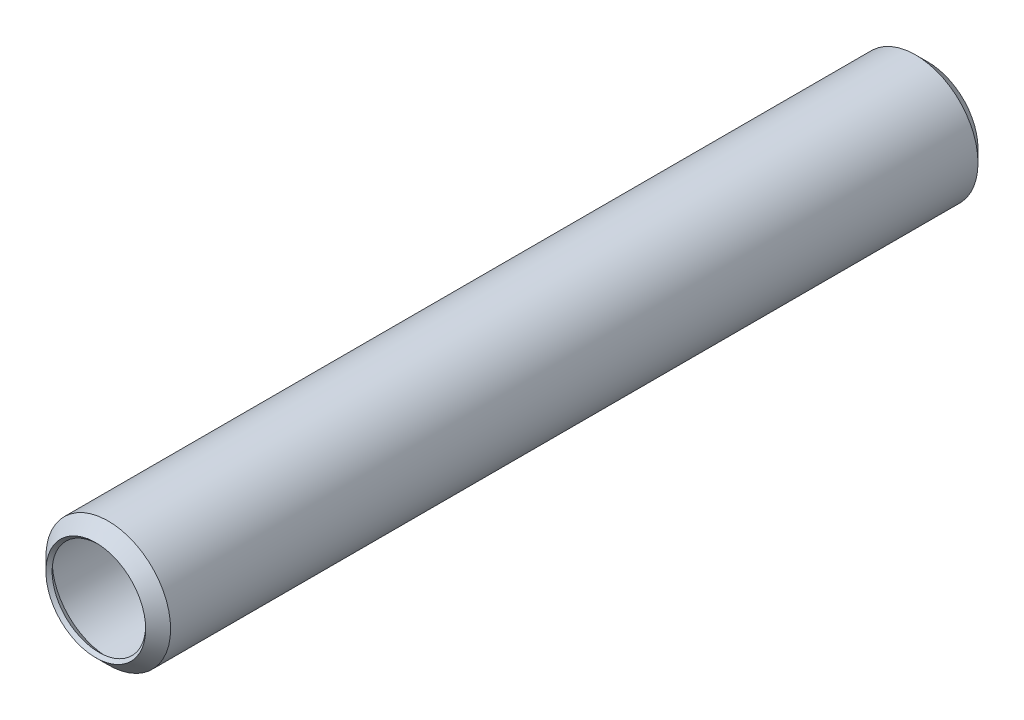
from build123d import *


with BuildPart() as part:
    # Croquis4 → Revolución1 (revolve)
    with BuildSketch(Plane(origin=(0, 0, 0), x_dir=(0, 0, -1), z_dir=(1, 0, 0)), mode=Mode.PRIVATE) as revoluci_n1_sk:
        Polygon((-64.75, 10), (64.75, 10), (66.75, 8), (66.25, 7.5), (64.75, 9), (-64.75, 9), (-66.25, 7.5), (-66.75, 8), align=None)
    revolve(revoluci_n1_sk.sketch.rotate(Axis((0, 0, 0), (0, 0, -1)), 90), axis=Axis((0, 0, 0), (0, 0, -1)))


solid = part.part
